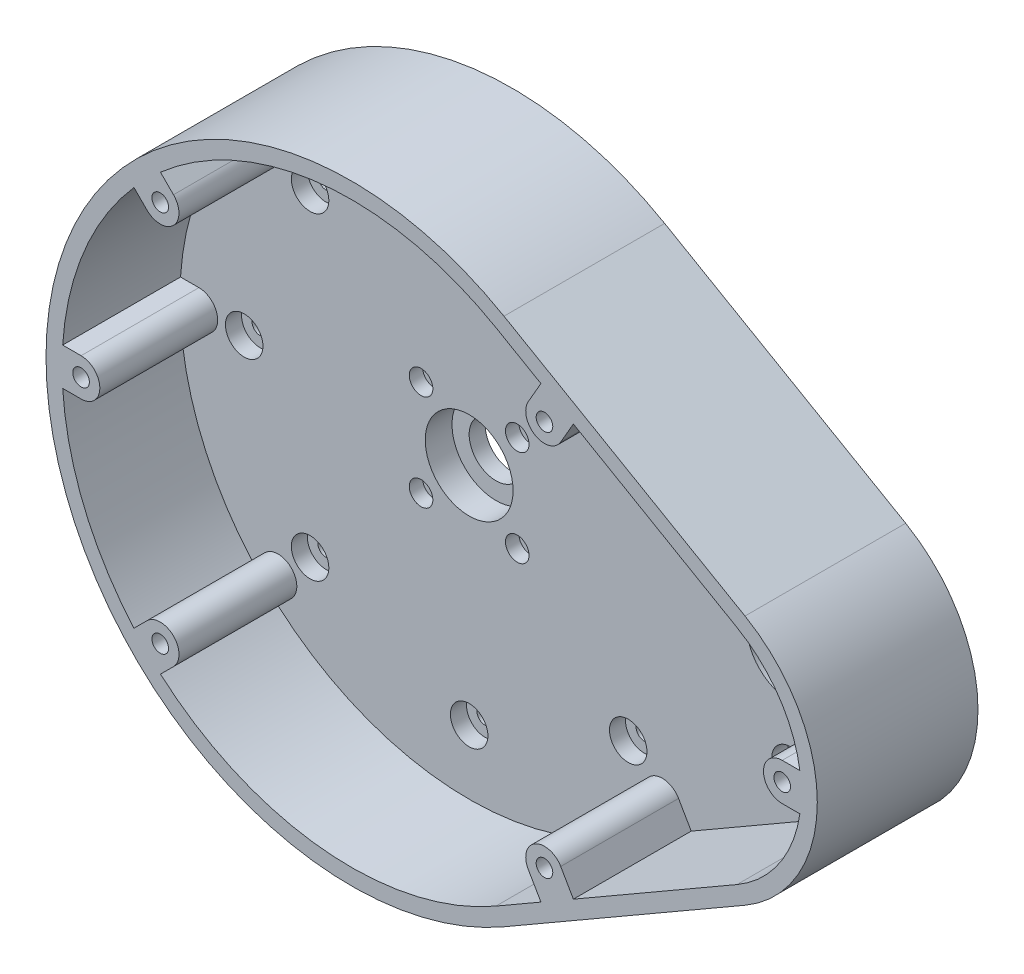
from build123d import *

# Parameters (mm, degrees)
BOSS_EXTRUDE1_DEPTH = 30
SKETCH3_R           = 1.55
CUT_EXTRUDE1_DEPTH  = 22
CUT_EXTRUDE2_START  = -30
SKETCH5_R           = 1.55
CUT_EXTRUDE2_DEPTH  = 30
CUT_EXTRUDE3_START  = -5
SKETCH6_R           = 3.5
CUT_EXTRUDE3_DEPTH  = 5
SKETCH7_R           = 8.2
CUT_EXTRUDE10_DEPTH = 5
SKETCH8_R           = 5
SKETCH8_R_2         = 1.05
CUT_EXTRUDE7_DEPTH  = 8
SKETCH9_R           = 2.2
CUT_EXTRUDE8_DEPTH  = 2.5
SKETCH11_R          = 1.55
CUT_EXTRUDE11_DEPTH = 8
SKETCH12_R          = 3.5
CUT_EXTRUDE12_DEPTH = 3


with BuildPart() as part:
    # Sketch1 → Boss-Extrude1 (new body)
    with BuildSketch(Plane.XY):
        with BuildLine():
            Line((-1.5, 49.363448016), (43.5, 23.382685902))
            ThreePointArc((43.5, 23.382685902), (57, 0), (43.5, -23.382685902))
            Line((43.5, -23.382685902), (-1.5, -49.363448016))
            ThreePointArc((-1.5, -49.363448016), (-87, 0), (-1.5, 49.363448016))
        make_face()
    extrude(amount=BOSS_EXTRUDE1_DEPTH)

    # Sketch3 → Cut-Extrude1 (cut)
    with BuildSketch(Plane.XY.offset(30)):
        with Locations((50.449984706, 0.025940866)):
            Circle(SKETCH3_R)
        with Locations((-80.45, 0)):
            Circle(SKETCH3_R)
        with Locations((-65.673537111, 35.673537111)):
            Circle(SKETCH3_R)
        with Locations((-65.673537111, -35.673537111)):
            Circle(SKETCH3_R)
        with Locations((6.062445841, 36.062445841)):
            Circle(SKETCH3_R)
        with Locations((6.062445841, -36.062445841)):
            Circle(SKETCH3_R)
        with BuildLine():
            Line((-3, -46.765371804), (5.400248357, -41.915486154))
            Line((5.400248357, -41.915486154), (3.031356927, -37.812445841))
            ThreePointArc((3.031356927, -37.812445841), (4.312445841, -33.031356927), (9.093534754, -34.312445841))
            Line((9.093534754, -34.312445841), (11.462426183, -38.415486154))
            Line((11.462426183, -38.415486154), (42, -20.784609691))
            ThreePointArc((42, -20.784609691), (49.859000377, -13.476650327), (53.747229589, -3.474059134))
            Line((53.747229589, -3.474059134), (50.449984706, -3.474059134))
            ThreePointArc((50.449984706, -3.474059134), (46.949984706, 0.025940866), (50.449984706, 3.525940866))
            Line((50.449984706, 3.525940866), (53.739581736, 3.525940866))
            ThreePointArc((53.739581736, 3.525940866), (49.844264614, 13.498339229), (42, 20.784609691))
            Line((42, 20.784609691), (11.462426183, 38.415486154))
            Line((11.462426183, 38.415486154), (9.093534754, 34.312445841))
            ThreePointArc((9.093534754, 34.312445841), (4.312445841, 33.031356927), (3.031356927, 37.812445841))
            Line((3.031356927, 37.812445841), (5.400248357, 41.915486154))
            Line((5.400248357, 41.915486154), (-3, 46.765371804))
            ThreePointArc((-3, 46.765371804), (-35.308766962, 53.738412643), (-65.628603797, 40.578351266))
            Line((-65.628603797, 40.578351266), (-63.198663377, 38.148410845))
            ThreePointArc((-63.198663377, 38.148410845), (-63.198663377, 33.198663377), (-68.148410845, 33.198663377))
            Line((-68.148410845, 33.198663377), (-70.578351266, 35.628603797))
            ThreePointArc((-70.578351266, 35.628603797), (-79.889494756, 20.664905348), (-83.886454699, 3.5))
            Line((-83.886454699, 3.5), (-80.45, 3.5))
            ThreePointArc((-80.45, 3.5), (-76.95, 0), (-80.45, -3.5))
            Line((-80.45, -3.5), (-83.886454699, -3.5))
            ThreePointArc((-83.886454699, -3.5), (-79.889494756, -20.664905348), (-70.578351266, -35.628603797))
            Line((-70.578351266, -35.628603797), (-68.148410845, -33.198663377))
            ThreePointArc((-68.148410845, -33.198663377), (-63.198663377, -33.198663377), (-63.198663377, -38.148410845))
            Line((-63.198663377, -38.148410845), (-65.628603797, -40.578351266))
            ThreePointArc((-65.628603797, -40.578351266), (-35.308766962, -53.738412643), (-3, -46.765371804))
        make_face()
    extrude(amount=-CUT_EXTRUDE1_DEPTH, mode=Mode.SUBTRACT)

    # Sketch5 → Cut-Extrude2 (cut)
    with BuildSketch(Plane(origin=(0, 0, 0), x_dir=(-1, 0, 0), z_dir=(0, 0, -1)).offset(CUT_EXTRUDE2_START)):
        with Locations(Location((80.45, 0, 0), (0, 0, 180))):
            Circle(SKETCH5_R)
        with Locations(Location((-50.449984706, 0.025940866, 0), (0, 0, 180))):
            Circle(SKETCH5_R)
        with Locations(Location((-6.062445841, -36.062445841, 0), (0, 0, 180))):
            Circle(SKETCH5_R)
        with Locations(Location((-6.062445841, 36.062445841, 0), (0, 0, 180))):
            Circle(SKETCH5_R)
        with Locations(Location((65.673537111, 35.673537111, 0), (0, 0, 180))):
            Circle(SKETCH5_R)
        with Locations(Location((65.673537111, -35.673537111, 0), (0, 0, 180))):
            Circle(SKETCH5_R)
    extrude(amount=CUT_EXTRUDE2_DEPTH, mode=Mode.SUBTRACT)

    # Sketch6 → Cut-Extrude3 (cut)
    with BuildSketch(Plane(origin=(0, 0, 0), x_dir=(-1, 0, 0), z_dir=(0, 0, -1)).offset(CUT_EXTRUDE3_START)):
        with Locations((-50.449984706, 0.025940866)):
            Circle(SKETCH6_R)
        with Locations((80.45, 0)):
            Circle(SKETCH6_R)
        with Locations((65.673537111, 35.673537111)):
            Circle(SKETCH6_R)
        with Locations((-6.062445841, 36.062445841)):
            Circle(SKETCH6_R)
        with Locations((65.673537111, -35.673537111)):
            Circle(SKETCH6_R)
        with Locations((-6.062445841, -36.062445841)):
            Circle(SKETCH6_R)
    extrude(amount=CUT_EXTRUDE3_DEPTH, mode=Mode.SUBTRACT)

    # Sketch7 → Cut-Extrude10 (cut)
    with BuildSketch(Plane.XY.offset(8)):
        with Locations((-30, 0)):
            Circle(SKETCH7_R)
        with Locations((30, 0)):
            Circle(SKETCH7_R)
    extrude(amount=-CUT_EXTRUDE10_DEPTH, mode=Mode.SUBTRACT)

    # Sketch8 → Cut-Extrude7 (cut)
    with BuildSketch(Plane.XY.offset(8)):
        with Locations((-30, 0)):
            Circle(SKETCH8_R)
        with Locations((-38.980256121, 8.980256121)):
            Circle(SKETCH8_R_2)
        with Locations((-21.019743879, 8.980256121)):
            Circle(SKETCH8_R_2)
        with Locations((-21.019743879, -8.980256121)):
            Circle(SKETCH8_R_2)
        with Locations((-38.980256121, -8.980256121)):
            Circle(SKETCH8_R_2)
    extrude(amount=-CUT_EXTRUDE7_DEPTH, mode=Mode.SUBTRACT)

    # Sketch9 → Cut-Extrude8 (cut)
    with BuildSketch(Plane.XY.offset(8)):
        with Locations((-38.980256121, 8.980256121)):
            Circle(SKETCH9_R)
        with Locations((-21.019743879, 8.980256121)):
            Circle(SKETCH9_R)
        with Locations((-21.019743879, -8.980256121)):
            Circle(SKETCH9_R)
        with Locations((-38.980256121, -8.980256121)):
            Circle(SKETCH9_R)
    extrude(amount=-CUT_EXTRUDE8_DEPTH, mode=Mode.SUBTRACT)

    # Sketch11 → Cut-Extrude11 (cut)
    with BuildSketch(Plane.XY.offset(8)):
        with Locations((-0.30151519, 29.69848481)):
            Circle(SKETCH11_R)
        with Locations((-30, 42)):
            Circle(SKETCH11_R)
        with Locations((-59.69848481, 29.69848481)):
            Circle(SKETCH11_R)
        with Locations((-72, 0)):
            Circle(SKETCH11_R)
        with Locations((-59.69848481, -29.69848481)):
            Circle(SKETCH11_R)
        with Locations((-30, -42)):
            Circle(SKETCH11_R)
        with Locations((-0.30151519, -29.69848481)):
            Circle(SKETCH11_R)
        with Locations((30, 19)):
            Circle(SKETCH11_R)
        with Locations((30, -19)):
            Circle(SKETCH11_R)
        with Locations((42, 0)):
            Circle(SKETCH11_R)
    extrude(amount=-CUT_EXTRUDE11_DEPTH, mode=Mode.SUBTRACT)

    # Sketch12 → Cut-Extrude12 (cut)
    with BuildSketch(Plane.XY.offset(8)):
        with Locations((-0.30151519, 29.69848481)):
            Circle(SKETCH12_R)
        with Locations((-30, 42)):
            Circle(SKETCH12_R)
        with Locations((-59.69848481, 29.69848481)):
            Circle(SKETCH12_R)
        with Locations((-72, 0)):
            Circle(SKETCH12_R)
        with Locations((-59.69848481, -29.69848481)):
            Circle(SKETCH12_R)
        with Locations((-30, -42)):
            Circle(SKETCH12_R)
        with Locations((-0.30151519, -29.69848481)):
            Circle(SKETCH12_R)
        with Locations((30, 19)):
            Circle(SKETCH12_R)
        with Locations((42, 0)):
            Circle(SKETCH12_R)
        with Locations((30, -19)):
            Circle(SKETCH12_R)
    extrude(amount=-CUT_EXTRUDE12_DEPTH, mode=Mode.SUBTRACT)


solid = part.part
